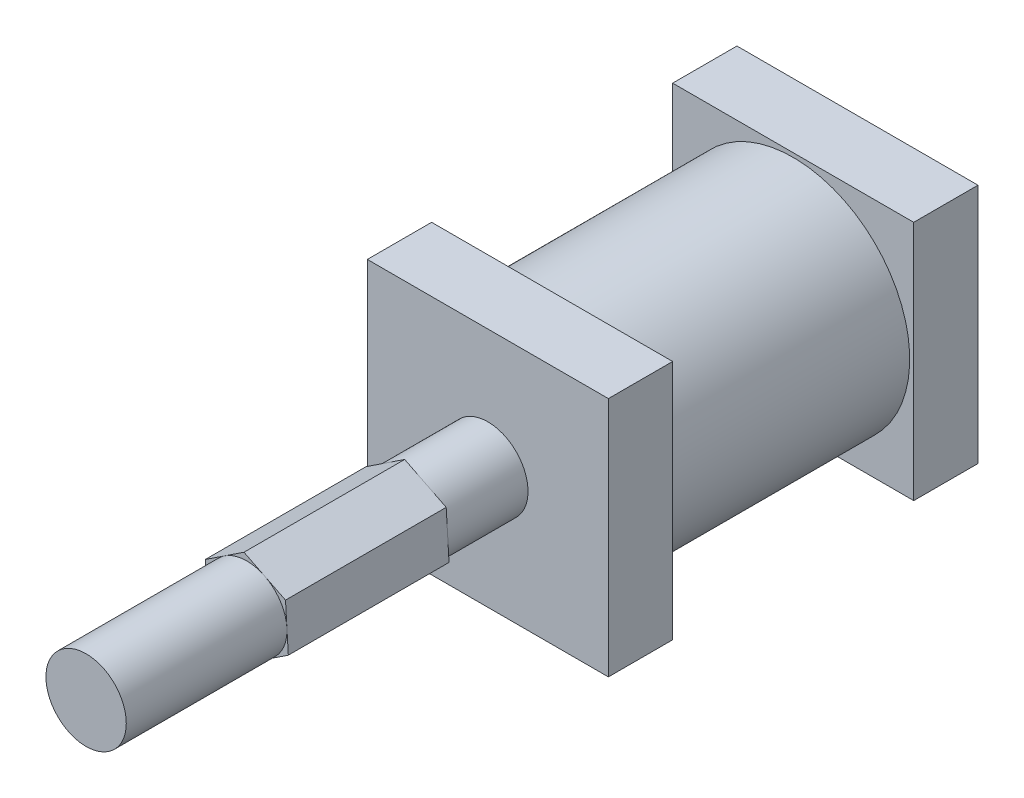
from build123d import *

# Parameters (mm, degrees)
SKETCH1_W           = 38.1
SKETCH1_H           = 38.1
BOSS_EXTRUDE1_DEPTH = 10.16
SKETCH2_R           = 18.415
BOSS_EXTRUDE2_DEPTH = 38.1
SKETCH3_W           = 38.1
SKETCH3_H           = 38.1
BOSS_EXTRUDE3_DEPTH = 10.16
SKETCH4_R           = 6.35
BOSS_EXTRUDE4_DEPTH = 12.7
BOSS_EXTRUDE5_DEPTH = 25.4
SKETCH6_R           = 6.35
BOSS_EXTRUDE6_DEPTH = 25.4


with BuildPart() as part:
    # Sketch1 → Boss-Extrude1 (new body)
    with BuildSketch(Plane.XY):
        with Locations((19.05, 19.05)):
            Rectangle(SKETCH1_W, SKETCH1_H)
    extrude(amount=BOSS_EXTRUDE1_DEPTH)

    # Sketch2 → Boss-Extrude2 (add)
    with BuildSketch(Plane.XY.offset(10.16)):
        with Locations(Location((19.05, 19.05, 0), (0, 0, 180))):
            Circle(SKETCH2_R)
    extrude(amount=BOSS_EXTRUDE2_DEPTH)

    # Sketch3 → Boss-Extrude3 (add)
    with BuildSketch(Plane.XY.offset(48.26)):
        with Locations((19.05, 19.05)):
            Rectangle(SKETCH3_W, SKETCH3_H)
    extrude(amount=BOSS_EXTRUDE3_DEPTH)

    # Sketch4 → Boss-Extrude4 (add)
    with BuildSketch(Plane.XY.offset(58.42)):
        with Locations(Location((19.05, 19.05, 0), (0, 0, 180))):
            Circle(SKETCH4_R)
    extrude(amount=BOSS_EXTRUDE4_DEPTH)

    # Sketch5 → Boss-Extrude5 (add)
    with BuildSketch(Plane.XY.offset(71.12)):
        Polygon((25.164098612, 23.097361053), (18.601931816, 26.368645246), (12.487833204, 22.321284193), (12.935901388, 15.002638947), (19.498068184, 11.731354754), (25.612166796, 15.778715807), align=None)
    extrude(amount=BOSS_EXTRUDE5_DEPTH)

    # Sketch6 → Boss-Extrude6 (add)
    with BuildSketch(Plane.XY.offset(96.52)):
        with Locations(Location((19.05, 19.05, 0), (0, 0, 180))):
            Circle(SKETCH6_R)
    extrude(amount=BOSS_EXTRUDE6_DEPTH)


solid = part.part
